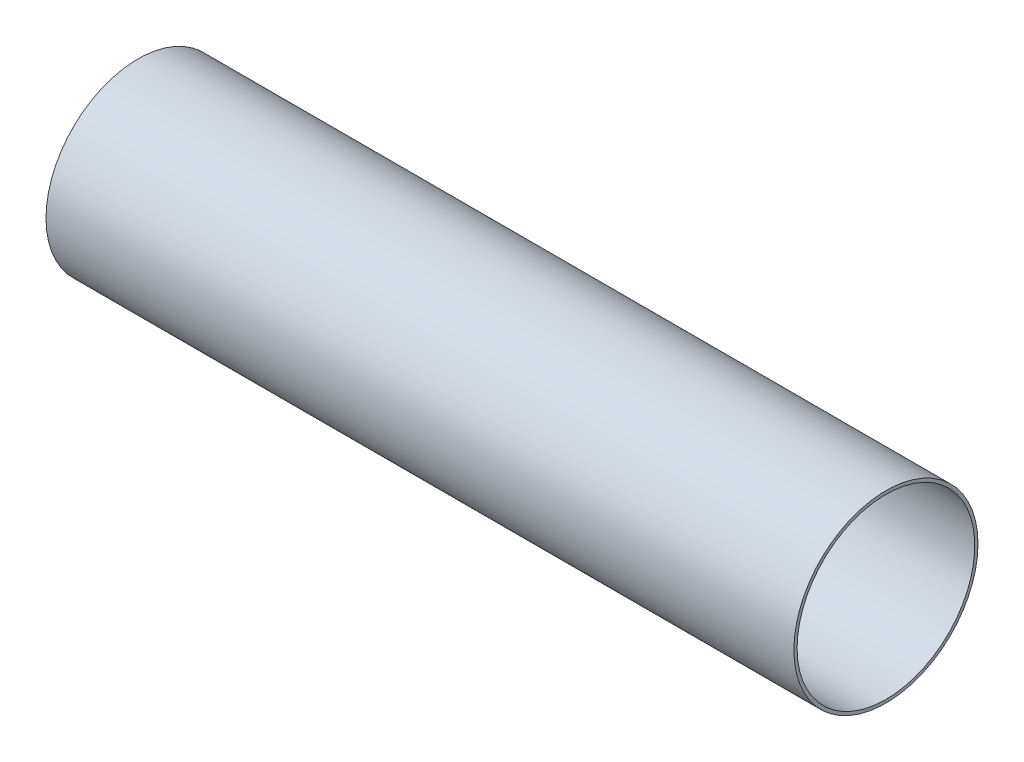
from build123d import *

# Parameters (mm, degrees)
SKETCH3_W = 463
SKETCH3_H = 2


with BuildPart() as part:
    # Sketch3 → Revolve1 (revolve)
    with BuildSketch(Plane.XY, mode=Mode.PRIVATE) as revolve1_sk:
        with Locations((231.5, 56)):
            Rectangle(SKETCH3_W, SKETCH3_H)
    revolve(revolve1_sk.sketch.rotate(Axis((0, 0, 0), (1, 0, 0)), 90), axis=Axis((0, 0, 0), (1, 0, 0)))


solid = part.part
